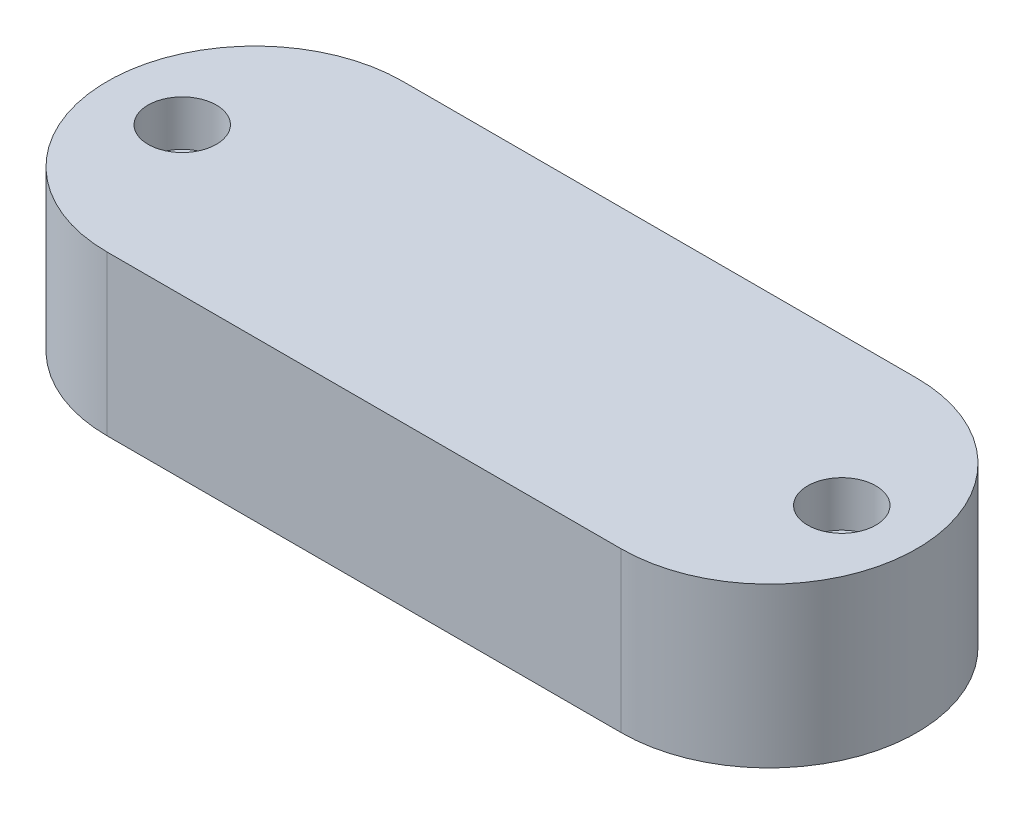
from build123d import *

# Parameters (mm, degrees)
EXTRUDE_1_DEPTH     = 7
SKETCH_2_R          = 1.5
CUT_EXTRUDE_1_DEPTH = 2


with BuildPart() as part:
    # 草图1 → 凸台-拉伸1 (new body)
    with BuildSketch(Plane(origin=(0, 0, 0), x_dir=(1, 0, 0), z_dir=(0, 1, 0))):
        with BuildLine():
            Line((-11.3, 6.5), (11.3, 6.5))
            ThreePointArc((11.3, 6.5), (17.8, 0), (11.3, -6.5))
            Line((11.3, -6.5), (-11.3, -6.5))
            ThreePointArc((-11.3, -6.5), (-17.8, 0), (-11.3, 6.5))
        make_face()
    extrude(amount=EXTRUDE_1_DEPTH)

    # 草图2 → 切除-拉伸1 (cut)
    with BuildSketch(Plane(origin=(0, 7, 0), x_dir=(1, 0, 0), z_dir=(0, 1, 0))):
        with Locations(Location((14.5, 0, 0), (0, 0, 270))):
            Circle(SKETCH_2_R)
        with Locations(Location((-14.5, 0, 0), (0, 0, 90))):
            Circle(SKETCH_2_R)
    extrude(amount=-CUT_EXTRUDE_1_DEPTH, mode=Mode.SUBTRACT)


solid = part.part
